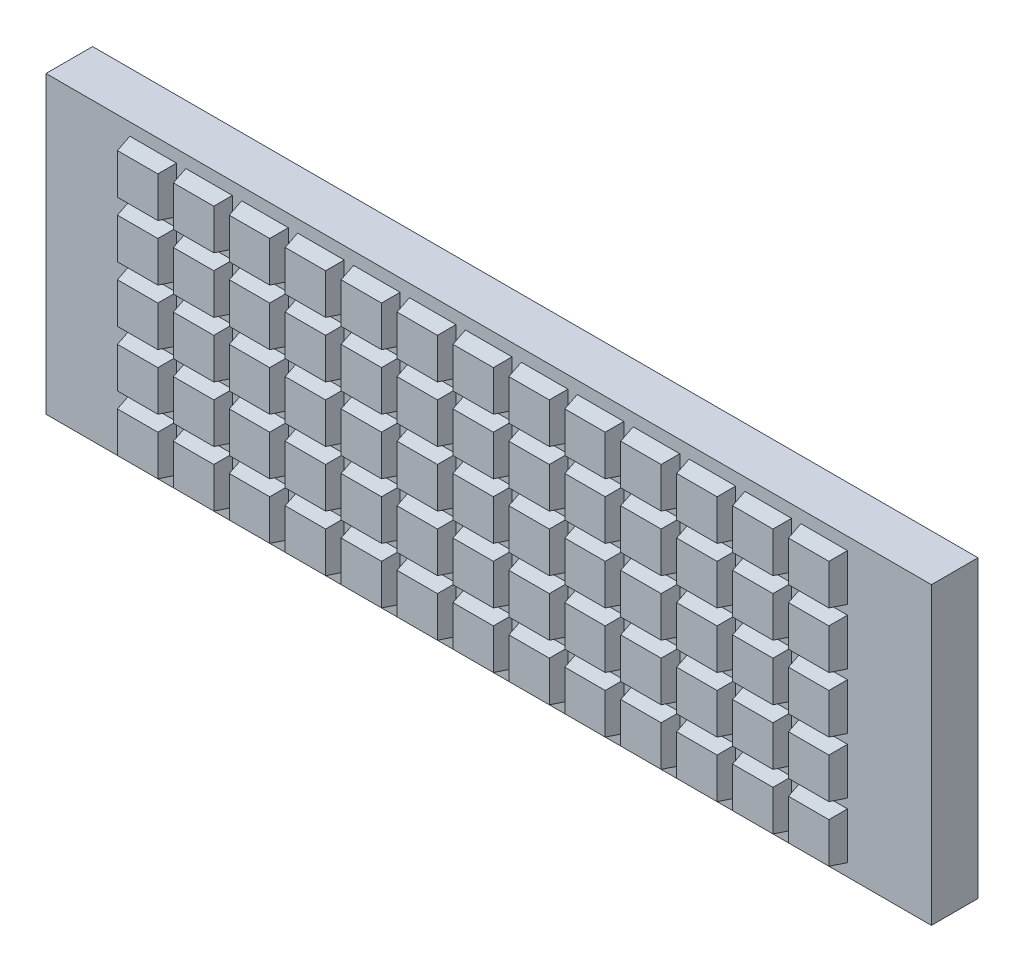
from build123d import *

# Parameters (mm, degrees)
SKETCH_1_W                  = 285
SKETCH_1_H                  = 95
EXTRUDE_1_DEPTH             = 15
PATTERN_LINEAR_1_COUNT      = 13
PATTERN_LINEAR_1_PITCH      = 18
PATTERN_LINEAR_1_COUNT_DIR2 = 5
PATTERN_LINEAR_1_PITCH_DIR2 = 18


with BuildPart() as part:
    # 草图1 → 凸台-拉伸1 (new body)
    with BuildSketch(Plane.XY):
        Rectangle(SKETCH_1_W, SKETCH_1_H)
    extrude(amount=EXTRUDE_1_DEPTH)

    # 草图2 → 放样1 section 0
    with BuildSketch(Plane.XY.offset(15)):
        with BuildLine():
            Line((-115.5, -43.5), (-100.5, -43.5))
            Line((-100.5, -43.5), (-100.5, -28.5))
            Line((-100.5, -28.5), (-115.5, -28.5))
            Line((-115.5, -28.5), (-115.5, -43.5))
        make_face()
    # 草图3 → 放样1 section 1
    with BuildSketch(Plane.XY.offset(20)):
        with BuildLine():
            Line((-114.5, -42.5), (-101.5, -42.5))
            Line((-101.5, -42.5), (-101.5, -29.5))
            Line((-101.5, -29.5), (-114.5, -29.5))
            Line((-114.5, -29.5), (-114.5, -42.5))
        make_face()
    loft_1 = loft()

    # 阵列(线性)1: Loft 1 13 × 5
    with Locations(*[(i * PATTERN_LINEAR_1_PITCH, j * PATTERN_LINEAR_1_PITCH_DIR2, 0) for i in range(PATTERN_LINEAR_1_COUNT) for j in range(PATTERN_LINEAR_1_COUNT_DIR2) if (i, j) != (0, 0)]):
        add(loft_1)


solid = part.part
